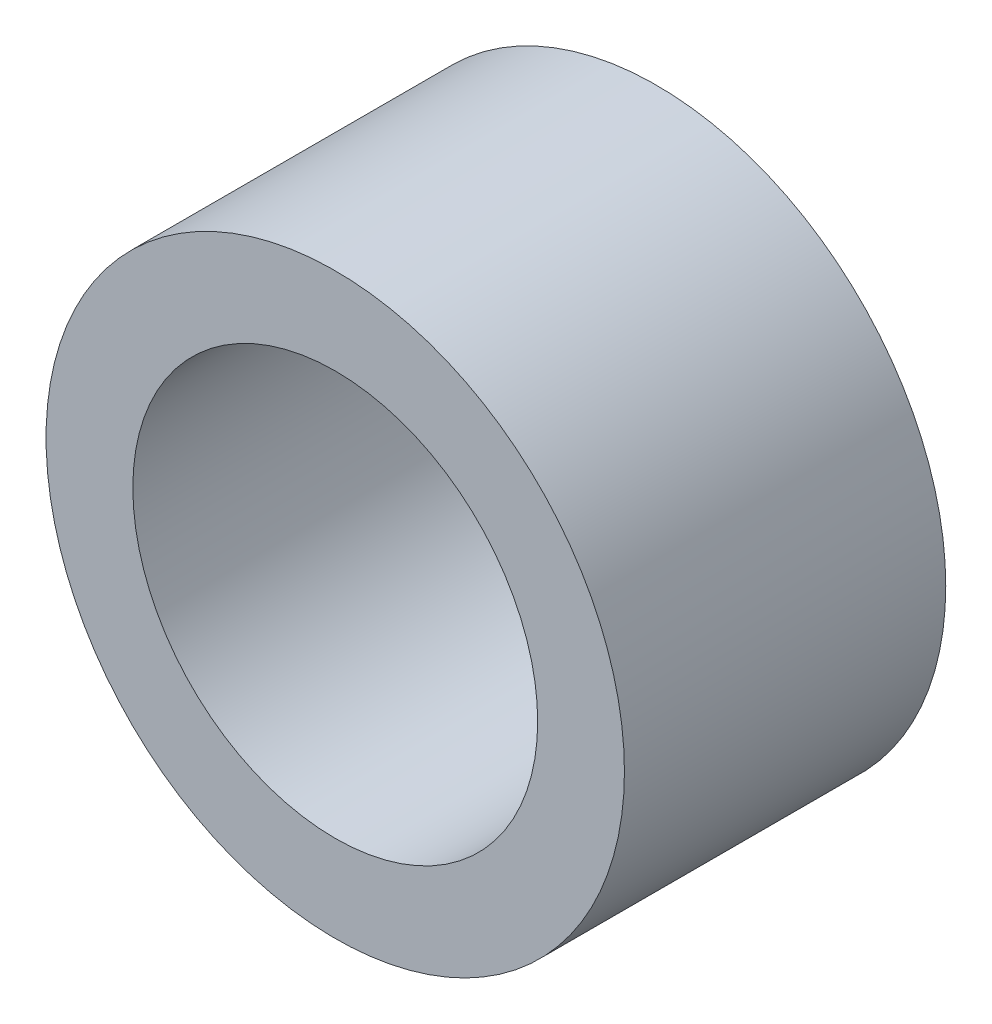
from build123d import *

# Parameters (mm, degrees)
SKETCH1_R           = 4.5
SKETCH1_R_2         = 3.15
BOSS_EXTRUDE1_DEPTH = 5


with BuildPart() as part:
    # Sketch1 → Boss-Extrude1 (new body)
    with BuildSketch(Plane.XY):
        Circle(SKETCH1_R)
        Circle(SKETCH1_R_2, mode=Mode.SUBTRACT)
    extrude(amount=BOSS_EXTRUDE1_DEPTH)


solid = part.part
